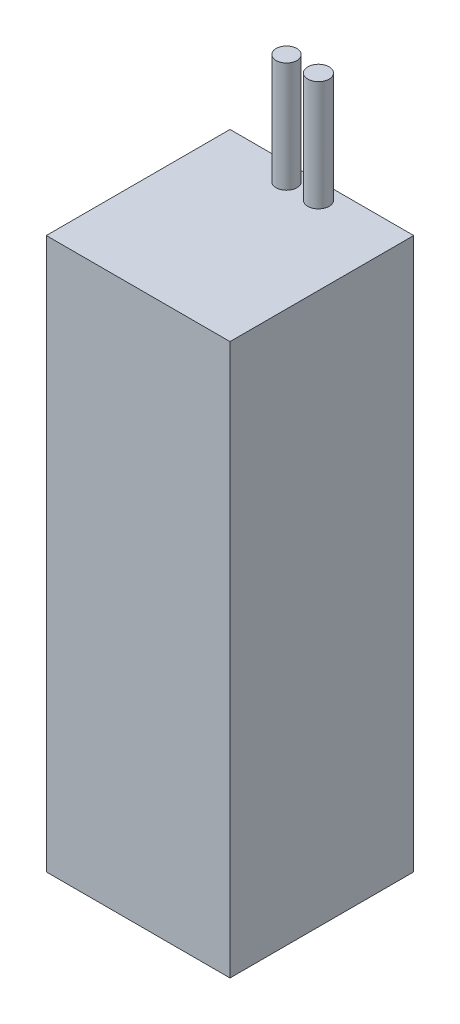
from build123d import *

# Parameters (mm, degrees)
SKETCH1_W           = 50
SKETCH1_H           = 50
BOSS_EXTRUDE1_DEPTH = 150
SKETCH2_R           = 2.833564276
SKETCH2_R_2         = 2.900040311
BOSS_EXTRUDE2_DEPTH = 30


with BuildPart() as part:
    # Sketch1 → Boss-Extrude1 (new body)
    with BuildSketch(Plane(origin=(0, 0, 0), x_dir=(1, 0, 0), z_dir=(0, 1, 0))):
        with Locations((25, 25)):
            Rectangle(SKETCH1_W, SKETCH1_H)
    extrude(amount=BOSS_EXTRUDE1_DEPTH)

    # Sketch2 → Boss-Extrude2 (add)
    with BuildSketch(Plane(origin=(0, 150, 0), x_dir=(1, 0, 0), z_dir=(0, 1, 0))):
        with Locations(Location((20.020083577, 45.354420301, 0), (0, 0, 90))):
            Circle(SKETCH2_R)
        with Locations(Location((28.715175744, 45.354420301, 0), (0, 0, 90))):
            Circle(SKETCH2_R_2)
    extrude(amount=BOSS_EXTRUDE2_DEPTH)


solid = part.part
